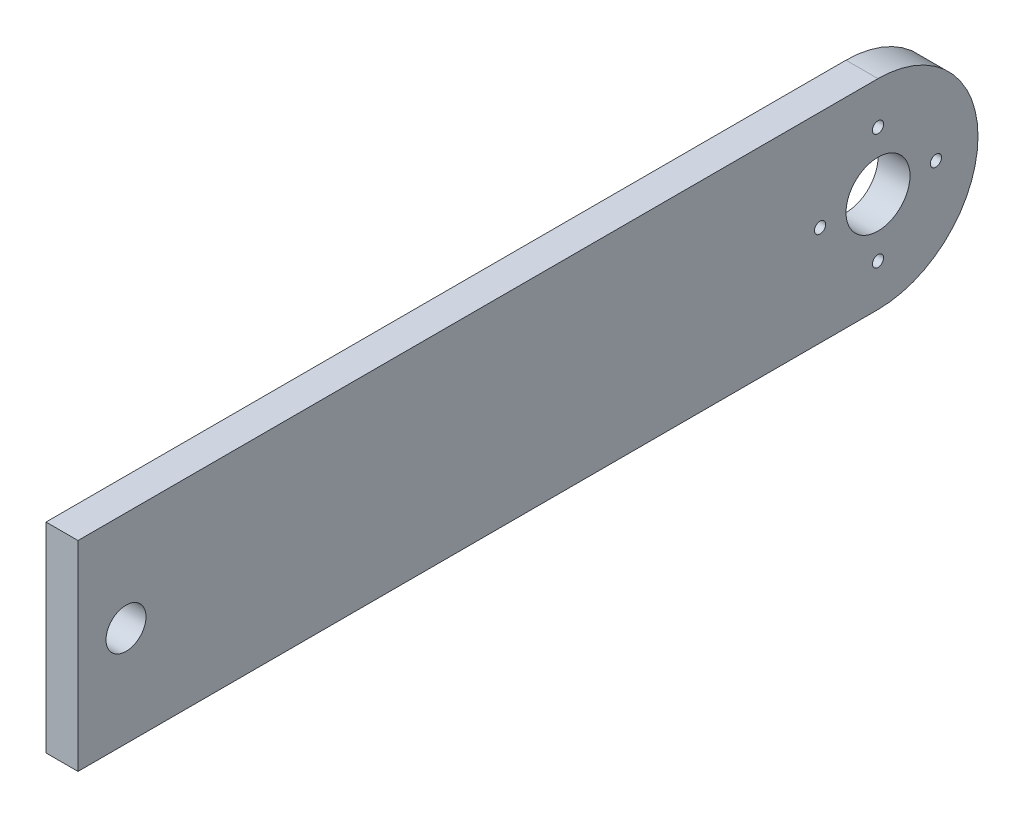
from build123d import *

# Parameters (mm, degrees)
SKETCH1_R           = 4
SKETCH1_R_2         = 0.7
BOSS_EXTRUDE1_DEPTH = 4
SKETCH3_R           = 2.5
CUT_EXTRUDE1_DEPTH  = 10


with BuildPart() as part:
    # Sketch1 → Boss-Extrude1 (new body)
    with BuildSketch(Plane(origin=(0, 0, 0), x_dir=(0, 0, -1), z_dir=(1, 0, 0))):
        with BuildLine():
            Line((-100, 12.5), (-100, -12.5))
            Line((-100, -12.5), (0, -12.5))
            ThreePointArc((0, -12.5), (12.5, 0), (0, 12.5))
            Line((0, 12.5), (-100, 12.5))
        make_face()
        Circle(SKETCH1_R, mode=Mode.SUBTRACT)
        with Locations((-7.24, 0)):
            Circle(SKETCH1_R_2, mode=Mode.SUBTRACT)
        with Locations((0, 7.24)):
            Circle(SKETCH1_R_2, mode=Mode.SUBTRACT)
        with Locations((7.24, 0)):
            Circle(SKETCH1_R_2, mode=Mode.SUBTRACT)
        with Locations((0, -7.24)):
            Circle(SKETCH1_R_2, mode=Mode.SUBTRACT)
    extrude(amount=BOSS_EXTRUDE1_DEPTH)

    # Sketch3 → Cut-Extrude1 (cut)
    with BuildSketch(Plane(origin=(4, 0, 0), x_dir=(0, 0, -1), z_dir=(1, 0, 0))):
        with Locations((-94, 0)):
            Circle(SKETCH3_R)
    extrude(amount=-CUT_EXTRUDE1_DEPTH, mode=Mode.SUBTRACT)


solid = part.part
